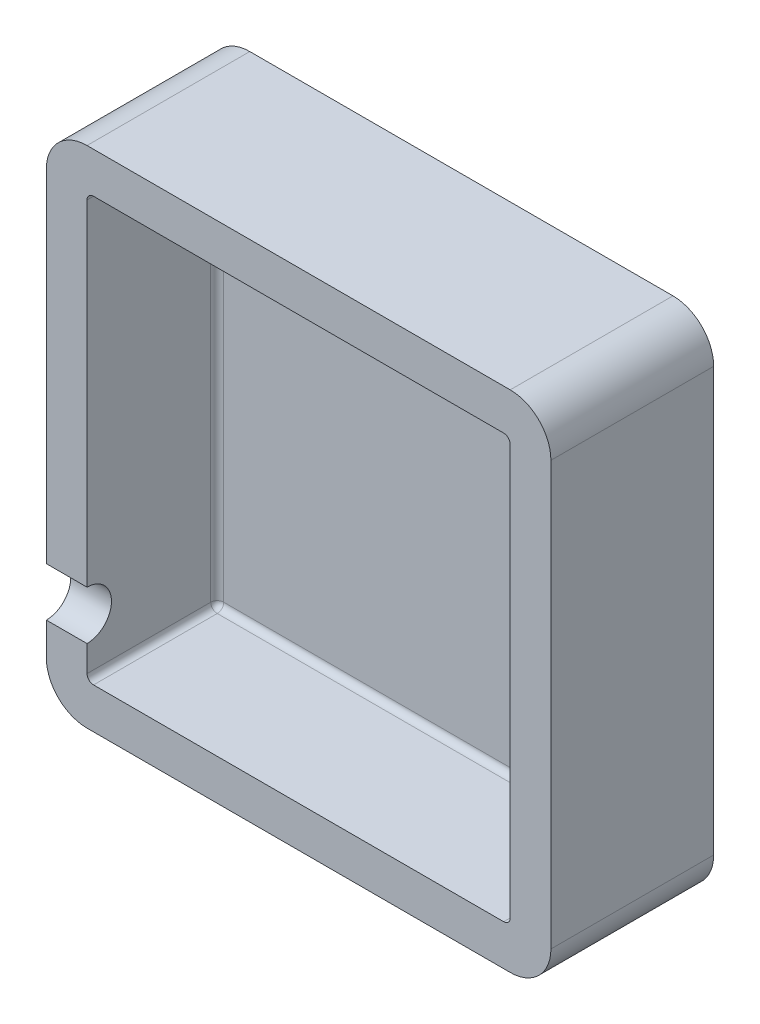
from build123d import *

# Parameters (mm, degrees)
SCHIZZO1_W                   = 31
SCHIZZO1_H                   = 31
SCHIZZO1_W_2                 = 26
SCHIZZO1_H_2                 = 26
ESTRUSIONE_SOTTILE1_DEPTH    = 8
SCHIZZO2_W                   = 31
SCHIZZO2_H                   = 31
ESTRUSIONE_ESTRUSIONE1_DEPTH = 2
RACCORDO1_R                  = 2.5
RACCORDO2_R                  = 0.4
TAGLIO_ESTRUSIONE1_REACH     = 37.57
SCHIZZO3_R                   = 1.5


with BuildPart() as part:
    # Schizzo1 → Estrusione-Sottile1 (new body)
    with BuildSketch(Plane.XY):
        Rectangle(SCHIZZO1_W, SCHIZZO1_H)
        Rectangle(SCHIZZO1_W_2, SCHIZZO1_H_2, mode=Mode.SUBTRACT)
    extrude(amount=ESTRUSIONE_SOTTILE1_DEPTH)

    # Schizzo2 → Estrusione-Estrusione1 (add)
    with BuildSketch(Plane(origin=(0, 0, 0), x_dir=(-1, 0, 0), z_dir=(0, 0, -1))):
        Rectangle(SCHIZZO2_W, SCHIZZO2_H)
    extrude(amount=ESTRUSIONE_ESTRUSIONE1_DEPTH)

    # Raccordo1
    raccordo1_edges = [part.edges().sort_by_distance(p)[0] for p in [
        (-15.5, 15.5, 3),
        (15.5, 15.5, 3),
        (15.5, -15.5, 3),
        (-15.5, -15.5, 3),
    ]]
    fillet(raccordo1_edges, radius=RACCORDO1_R)

    # Raccordo2
    raccordo2_edges = [part.edges().sort_by_distance(p)[0] for p in [
        (-13, 0, 0),
        (-13, 13, 4),
        (0, -13, 0),
        (-13, -13, 4),
        (13, 0, 0),
        (13, -13, 4),
        (0, 13, 0),
        (13, 13, 4),
    ]]
    fillet(raccordo2_edges, radius=RACCORDO2_R)

    # Schizzo3 → Taglio-Estrusione1 (cut, up to next)
    with BuildSketch(Plane.ZY.offset(15.5), mode=Mode.PRIVATE) as taglio_estrusione1_sk1:
        with Locations((8, -9.5)):
            Circle(SCHIZZO3_R)
    taglio_estrusione1_tool1 = extrude(taglio_estrusione1_sk1.sketch, amount=-TAGLIO_ESTRUSIONE1_REACH, mode=Mode.PRIVATE) & part.part
    add(taglio_estrusione1_tool1.solids().sort_by_distance((-15.5, -9.5, 8))[0], mode=Mode.SUBTRACT)


solid = part.part
